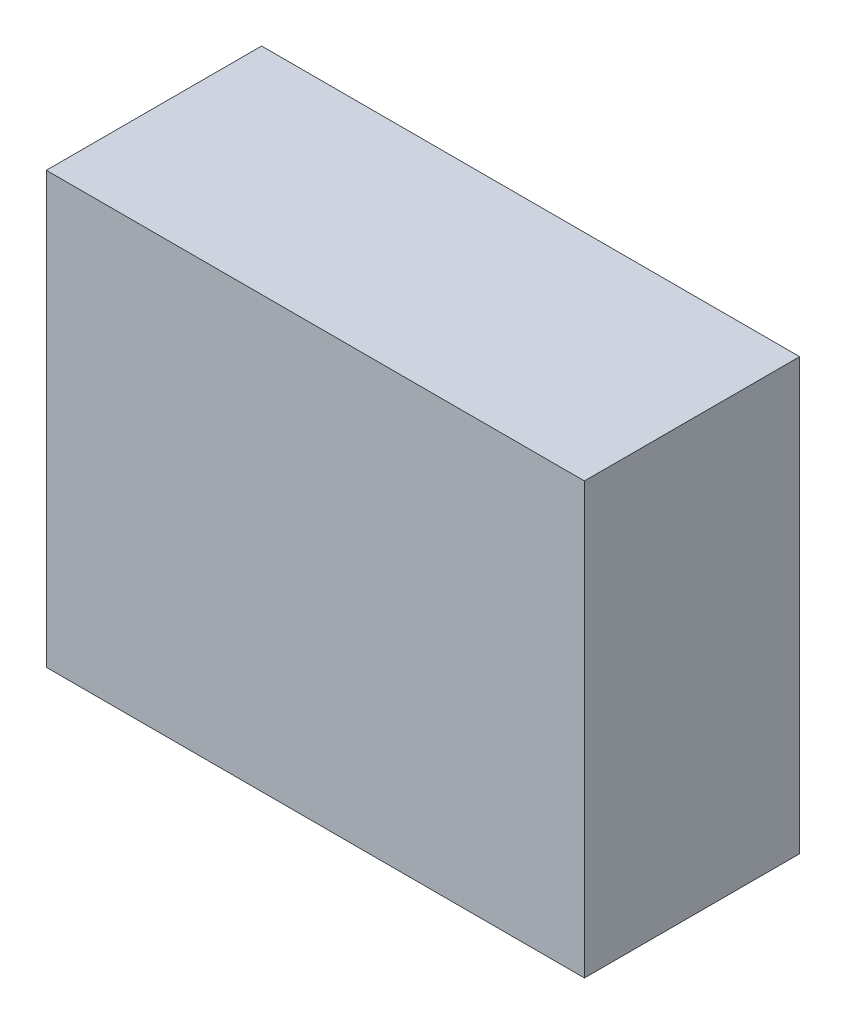
from build123d import *

# Parameters (mm, degrees)
SKETCH_1_W      = 50
SKETCH_1_H      = 40
EXTRUDE_1_DEPTH = 20


with BuildPart() as part:
    # 草图1 → 凸台-拉伸1 (new body)
    with BuildSketch(Plane.XY):
        Rectangle(SKETCH_1_W, SKETCH_1_H)
    extrude(amount=EXTRUDE_1_DEPTH)


solid = part.part
